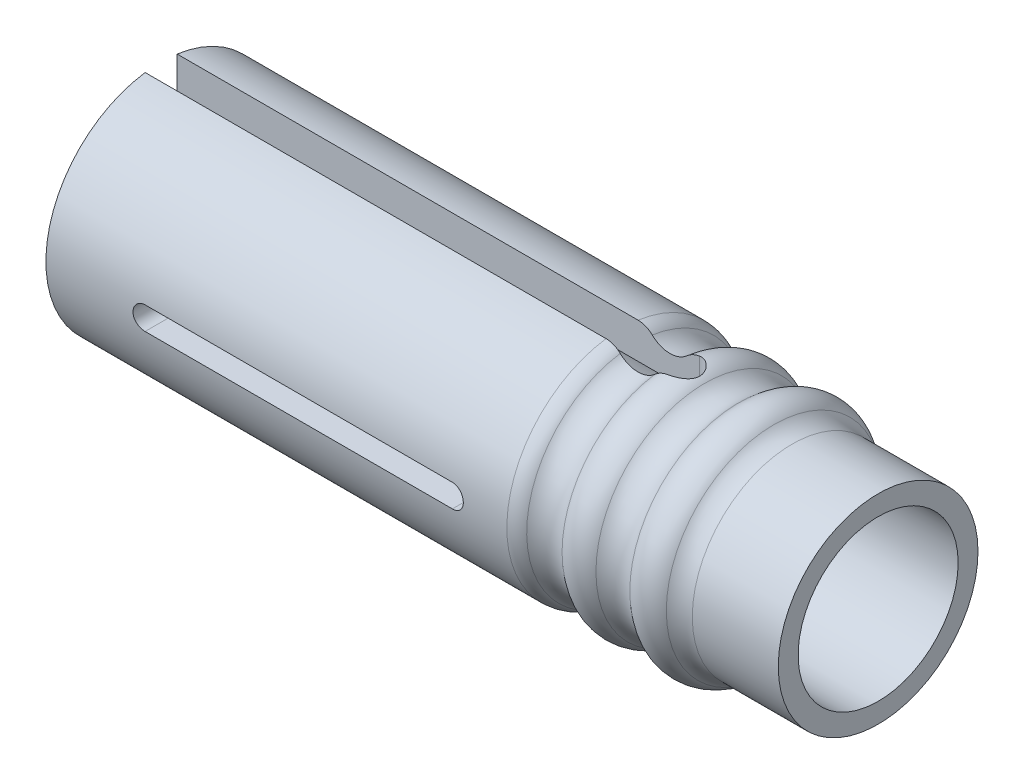
from build123d import *

# Parameters (mm, degrees)
CUT_EXTRUDE1_DEPTH           = 73.933834429
CUT_EXTRUDE2_DEPTH           = 73.933834429
F_5_8_0_625_DIAMETER_HOLE1_D = 15.875


with BuildPart() as part:
    # Sketch1 → Revolve1 (revolve)
    with BuildSketch(Plane.XY, mode=Mode.PRIVATE) as revolve1_sk:
        with BuildLine():
            Line((0, 0), (71.12, 0))
            Line((71.12, 0), (71.12, 9.906))
            Line((71.12, 9.906), (62.590432635, 9.906))
            ThreePointArc((62.590432635, 9.906), (61.606694865, 10.104235708), (60.776509814, 10.668))
            ThreePointArc((60.776509814, 10.668), (59.054850711, 11.428323739), (57.282534911, 10.795))
            ThreePointArc((57.282534911, 10.795), (55.602482828, 10.16), (53.922430745, 10.795))
            ThreePointArc((53.922430745, 10.795), (52.242378663, 11.43), (50.56232658, 10.795))
            ThreePointArc((50.56232658, 10.795), (48.830141803, 10.16053506), (47.125455332, 10.865555556))
            ThreePointArc((47.125455332, 10.865555556), (46.477281688, 11.283616198), (45.72, 11.43))
            Line((45.72, 11.43), (0, 11.43))
            Line((0, 11.43), (0, 0))
        make_face()
    revolve(revolve1_sk.sketch.rotate(Axis((0, 0, 0), (1, 0, 0)), 90), axis=Axis((0, 0, 0), (1, 0, 0)))

    # Sketch7 → Cut-Extrude1 (cut, through all)
    with BuildSketch(Plane.XY):
        with BuildLine():
            Line((9.779, 1.143), (40.259, 1.143))
            ThreePointArc((40.259, 1.143), (41.402, 0), (40.259, -1.143))
            Line((40.259, -1.143), (9.779, -1.143))
            ThreePointArc((9.779, -1.143), (8.636, 0), (9.779, 1.143))
        make_face()
    extrude(amount=CUT_EXTRUDE1_DEPTH, mode=Mode.SUBTRACT)

    # Sketch8 → Cut-Extrude2 (cut, through all)
    with BuildSketch(Plane(origin=(0, 0, 0), x_dir=(1, 0, 0), z_dir=(0, 1, 0))):
        with BuildLine():
            Line((0, -1.5875), (51.826930745, -1.5875))
            ThreePointArc((51.826930745, -1.5875), (53.414430745, 0), (51.826930745, 1.5875))
            Line((51.826930745, 1.5875), (0, 1.5875))
            Line((0, 1.5875), (0, -1.5875))
        make_face()
    extrude(amount=CUT_EXTRUDE2_DEPTH, mode=Mode.SUBTRACT)

    # 5/8 (0.625) Diameter Hole1 (through all)
    with Locations(Plane(origin=(71.12, 0, 0), x_dir=(0, 0, -1), z_dir=(1, 0, 0))):
        with Locations((0, 0)):
            Hole(F_5_8_0_625_DIAMETER_HOLE1_D / 2)


solid = part.part
